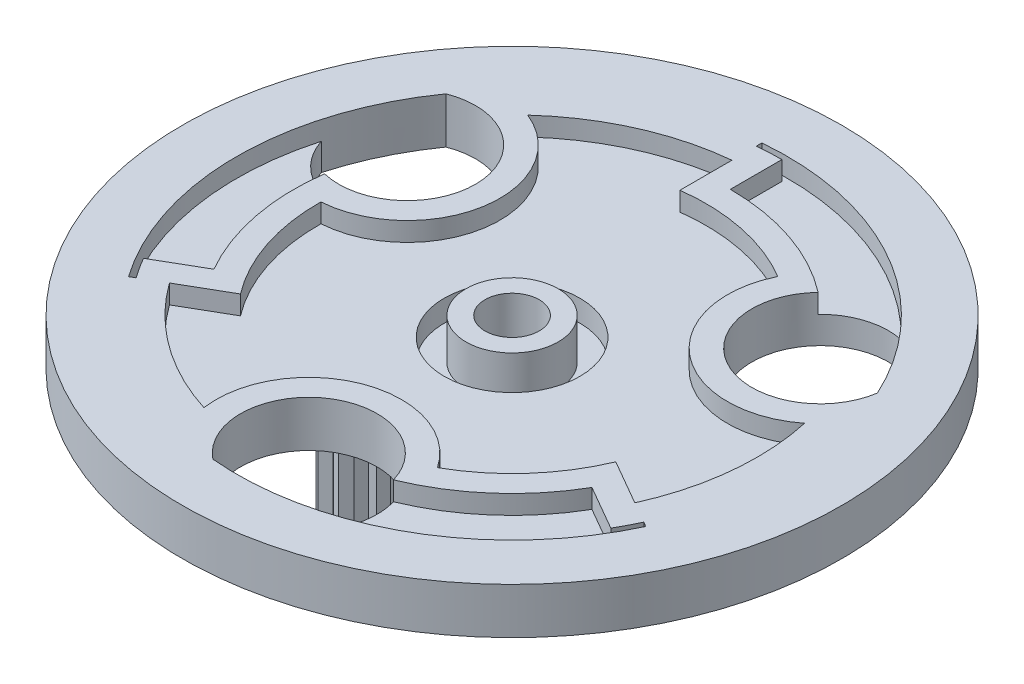
from build123d import *

# Parameters (mm, degrees)
SKETCH2_R           = 2.5
CUT_EXTRUDE1_DEPTH  = 0.7
CUT_EXTRUDE2_DEPTH  = 1
CIRPATTERN1_COUNT   = 3
BOSS_EXTRUDE1_START = 4.5
BOSS_EXTRUDE1_DEPTH = 4.5
CIRPATTERN2_COUNT   = 20


with BuildPart() as part:
    # Sketch1 → Revolve1 (revolve)
    with BuildSketch(Plane.XY, mode=Mode.PRIVATE) as revolve1_sk:
        Polygon((1, -3.75), (1, 3.75), (1.7, 3.75), (1.7, 2.25), (2.5, 2.25), (2.5, 3.75), (12.15, 3.75), (12.15, 2.05), (4, 2.05), (4, -2.45), (3.5, -2.45), (3.5, 0.25), (2.2, 0.25), (2.2, -2.45), (1.9, -2.45), (1.9, -3.75), align=None)
    revolve(revolve1_sk.sketch.rotate(Axis((0, -4.918604651, 0), (0, 1, 0)), 90), axis=Axis((0, -4.918604651, 0), (0, 1, 0)))

    # Sketch2 → Cut-Extrude1 (cut)
    # profile 1 of 4: a face of its own
    with BuildSketch(Plane(origin=(0, 3.75, 0), x_dir=(1, 0, 0), z_dir=(0, 1, 0))):
        with BuildLine():
            Line((-0.9, 9.005137423), (-0.9, 7.08903917))
            ThreePointArc((-0.9, 7.08903917), (1.458722277, 6.995470368), (3.658263916, 6.138532518))
            ThreePointArc((3.658263916, 6.138532518), (4.576321662, 1.976557769), (8.83823992, 1.946282384))
            ThreePointArc((8.83823992, 1.946282384), (9.001460613, -0.936059199), (8.248677773, -3.723145848))
            Line((8.248677773, -3.723145848), (6.58928801, -2.765096722))
            ThreePointArc((6.58928801, -2.765096722), (5.328893912, -4.761025733), (3.486993145, -6.237415744))
            ThreePointArc((3.486993145, -6.237415744), (-0.576411591, -4.951489699), (-2.733589973, -8.627281487))
            ThreePointArc((-2.733589973, -8.627281487), (-5.311381352, -7.327463963), (-7.348677773, -5.281991575))
            Line((-7.348677773, -5.281991575), (-5.68928801, -4.323942449))
            ThreePointArc((-5.68928801, -4.323942449), (-6.787616189, -2.234444635), (-7.145257061, 0.098883226))
            ThreePointArc((-7.145257061, 0.098883226), (-3.999910071, 2.97493193), (-6.104649947, 6.680999104))
            ThreePointArc((-6.104649947, 6.680999104), (-3.690079261, 8.263523162), (-0.9, 9.005137423))
        make_face()
        with Locations(Location((0, 0, 0), (0, 0, 90))):
            Circle(SKETCH2_R, mode=Mode.SUBTRACT)
    # profile 2 of 4: a face of its own
    with BuildSketch(Plane(origin=(0, 3.75, 0), x_dir=(1, 0, 0), z_dir=(0, 1, 0))):
        with BuildLine():
            Line((0, 9.945941251), (0, 8.045941251))
            ThreePointArc((0, 8.045941251), (2.592695888, 7.616764316), (4.908798836, 6.375018792))
            ThreePointArc((4.908798836, 6.375018792), (5.614265944, 2.374467718), (9.215155919, 4.254809208))
            ThreePointArc((9.215155919, 4.254809208), (5.08491172, 8.784427858), (-0.9, 10.110019782))
            Line((-0.9, 10.110019782), (-0.9, 9.905137423))
            ThreePointArc((-0.9, 9.905137423), (-0.450462249, 9.935735057), (0, 9.945941251))
        make_face()
    # profile 3 of 4: a face of its own
    with BuildSketch(Plane(origin=(0, 3.75, 0), x_dir=(1, 0, 0), z_dir=(0, 1, 0))):
        with BuildLine():
            Line((9.028100636, -4.173145848), (9.205533964, -4.275587028))
            ThreePointArc((9.205533964, -4.275587028), (5.065081823, -8.795876655), (-0.922805097, -10.107963729))
            ThreePointArc((-0.922805097, -10.107963729), (-0.750783607, -6.04933079), (3.066528805, -7.43865389))
            ThreePointArc((3.066528805, -7.43865389), (5.299963448, -6.053722661), (6.96798952, -4.022970625))
            Line((6.96798952, -4.022970625), (8.613437788, -4.972970625))
            ThreePointArc((8.613437788, -4.972970625), (8.829830089, -4.577755777), (9.028100636, -4.173145848))
        make_face()
    # profile 4 of 4: a face of its own
    with BuildSketch(Plane(origin=(0, 3.75, 0), x_dir=(1, 0, 0), z_dir=(0, 1, 0))):
        with BuildLine():
            Line((-8.128100636, -5.731991575), (-8.305533964, -5.834432755))
            ThreePointArc((-8.305533964, -5.834432755), (-10.149993543, 0.011448797), (-8.292350822, 5.853154521))
            ThreePointArc((-8.292350822, 5.853154521), (-4.863482336, 3.674863071), (-7.975327641, 1.063635098))
            ThreePointArc((-7.975327641, 1.063635098), (-7.892659336, -1.563041654), (-6.96798952, -4.022970625))
            Line((-6.96798952, -4.022970625), (-8.613437788, -4.972970625))
            ThreePointArc((-8.613437788, -4.972970625), (-8.37936784, -5.35797928), (-8.128100636, -5.731991575))
        make_face()
    extrude(amount=-CUT_EXTRUDE1_DEPTH, mode=Mode.SUBTRACT)

    # Sketch3 → Cut-Extrude2 (cut)
    with BuildSketch(Plane(origin=(0, 3.05, 0), x_dir=(1, 0, 0), z_dir=(0, 1, 0))):
        with BuildLine():
            ThreePointArc((4.908798836, 6.375018792), (5.614265944, 2.374467718), (9.215155919, 4.254809208))
            ThreePointArc((9.215155919, 4.254809208), (8.358955351, 5.757635403), (7.26002755, 7.093271457))
            ThreePointArc((7.26002755, 7.093271457), (5.990774307, 7.04067575), (4.908798836, 6.375018792))
        make_face()
    cut_extrude2 = extrude(amount=-CUT_EXTRUDE2_DEPTH, mode=Mode.SUBTRACT)

    # CirPattern1: Cut-Extrude2 ×3 about axis
    cirpattern1_axis = Axis((0, -4.918604651, 0), (0, -1, 0))
    for i in range(1, CIRPATTERN1_COUNT):
        add(cut_extrude2.rotate(cirpattern1_axis, i * 360 / CIRPATTERN1_COUNT), mode=Mode.SUBTRACT)

    # Sketch5 → Boss-Extrude1 (add)
    with BuildSketch(Plane.XZ.offset(-2.05).offset(BOSS_EXTRUDE1_START)):
        with BuildLine():
            Line((-0.3, 3.988734135), (-0.3, 4.777005146))
            Line((-0.3, 4.777005146), (-0.15, 5.14781507))
            ThreePointArc((-0.15, 5.14781507), (0, 5.15), (0.15, 5.14781507))
            Line((0.15, 5.14781507), (0.3, 4.777005146))
            Line((0.3, 4.777005146), (0.3, 3.988734135))
            ThreePointArc((0.3, 3.988734135), (0, 4), (-0.3, 3.988734135))
        make_face()
    boss_extrude1 = extrude(amount=-BOSS_EXTRUDE1_DEPTH)

    # CirPattern2: Boss-Extrude1 ×20 about axis
    cirpattern2_axis = Axis((0, 0, 0), (0, 1, 0))
    for i in range(1, CIRPATTERN2_COUNT):
        add(boss_extrude1.rotate(cirpattern2_axis, i * 360 / CIRPATTERN2_COUNT))


solid = part.part
